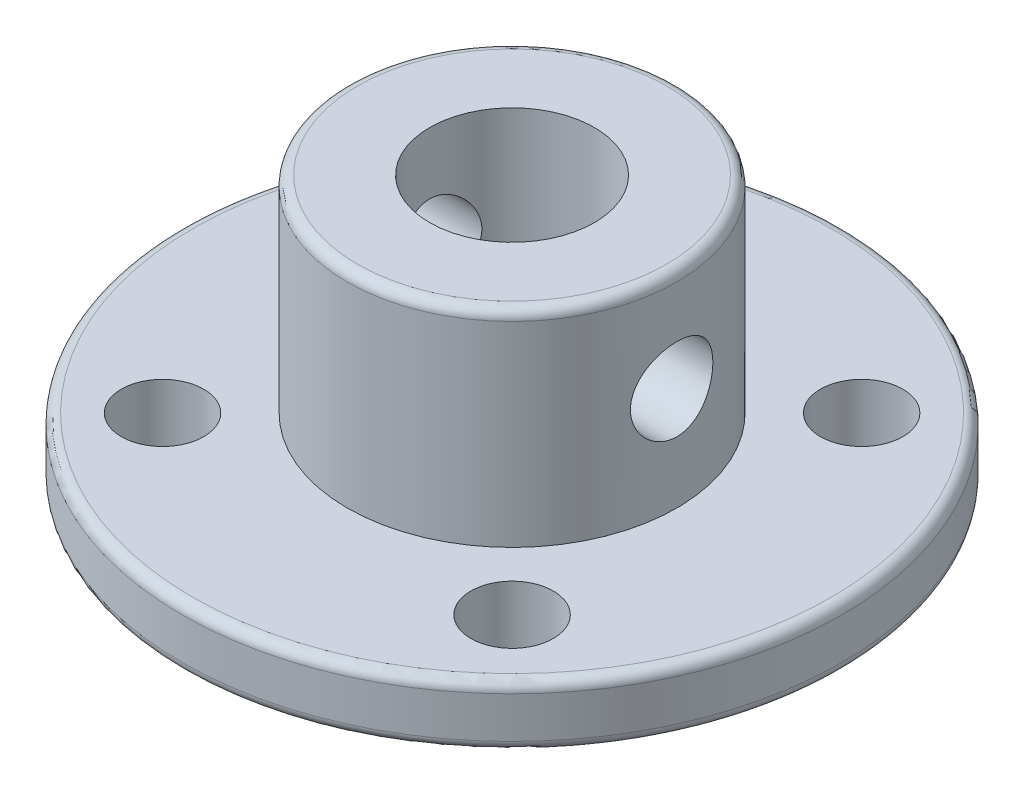
from build123d import *

# Parameters (mm, degrees)
SKETCH1_R               = 16
BOSS_EXTRUDE1_DEPTH     = 3
SKETCH2_R               = 8
BOSS_EXTRUDE2_DEPTH     = 10
SKETCH3_R               = 4
CUT_EXTRUDE1_DEPTH      = 13
SKETCH4_R               = 2
CUT_EXTRUDE3_DEPTH      = 3
CUT_EXTRUDE4_DEPTH      = 10
CUT_EXTRUDE4_DEPTH_BACK = 24
SKETCH6_R               = 2
FILLET1_R               = 0.5
FILLET3_R               = 0.5


with BuildPart() as part:
    # Sketch1 → Boss-Extrude1 (new body)
    with BuildSketch(Plane(origin=(0, 0, 0), x_dir=(1, 0, 0), z_dir=(0, 1, 0))):
        with Locations(Location((0, 0, 0), (0, 0, 270))):
            Circle(SKETCH1_R)
    extrude(amount=BOSS_EXTRUDE1_DEPTH)

    # Sketch2 → Boss-Extrude2 (add)
    with BuildSketch(Plane(origin=(0, 3, 0), x_dir=(1, 0, 0), z_dir=(0, 1, 0))):
        with Locations(Location((0, 0, 0), (0, 0, 270))):
            Circle(SKETCH2_R)
    extrude(amount=BOSS_EXTRUDE2_DEPTH)

    # Sketch3 → Cut-Extrude1 (cut)
    with BuildSketch(Plane(origin=(0, 13, 0), x_dir=(1, 0, 0), z_dir=(0, 1, 0))):
        with Locations(Location((0, 0, 0), (0, 0, 270))):
            Circle(SKETCH3_R)
    extrude(amount=-CUT_EXTRUDE1_DEPTH, mode=Mode.SUBTRACT)

    # Sketch4 → Cut-Extrude3 (cut)
    with BuildSketch(Plane(origin=(0, 3, 0), x_dir=(1, 0, 0), z_dir=(0, 1, 0))):
        with Locations(Location((8.485281374, 8.485281374, 0), (0, 0, 270))):
            Circle(SKETCH4_R)
        with Locations(Location((8.485281374, -8.485281374, 0), (0, 0, 270))):
            Circle(SKETCH4_R)
        with Locations(Location((-8.485281374, -8.485281374, 0), (0, 0, 270))):
            Circle(SKETCH4_R)
        with Locations(Location((-8.485281374, 8.485281374, 0), (0, 0, 270))):
            Circle(SKETCH4_R)
    extrude(amount=-CUT_EXTRUDE3_DEPTH, mode=Mode.SUBTRACT)

    # Sketch6 → Cut-Extrude4 (cut, two sides: drawn at the far end of the back side and taken through both)
    with BuildSketch(Plane(origin=(0, 0, 0), x_dir=(0, 0, -1), z_dir=(1, 0, 0)).offset(-CUT_EXTRUDE4_DEPTH_BACK)):
        with Locations(Location((0, 8, 0), (0, 0, 180))):
            Circle(SKETCH6_R)
    extrude(amount=CUT_EXTRUDE4_DEPTH + CUT_EXTRUDE4_DEPTH_BACK, mode=Mode.SUBTRACT)

    # Fillet1
    fillet1_edges = [part.edges().sort_by_distance(p)[0] for p in [
        (0, 0, -16),
    ]]
    fillet(fillet1_edges, radius=FILLET1_R)

    # Fillet3
    fillet3_edges = [part.edges().sort_by_distance(p)[0] for p in [
        (0, 3, -16),
        (0, 13, -8),
    ]]
    fillet(fillet3_edges, radius=FILLET3_R)


solid = part.part
